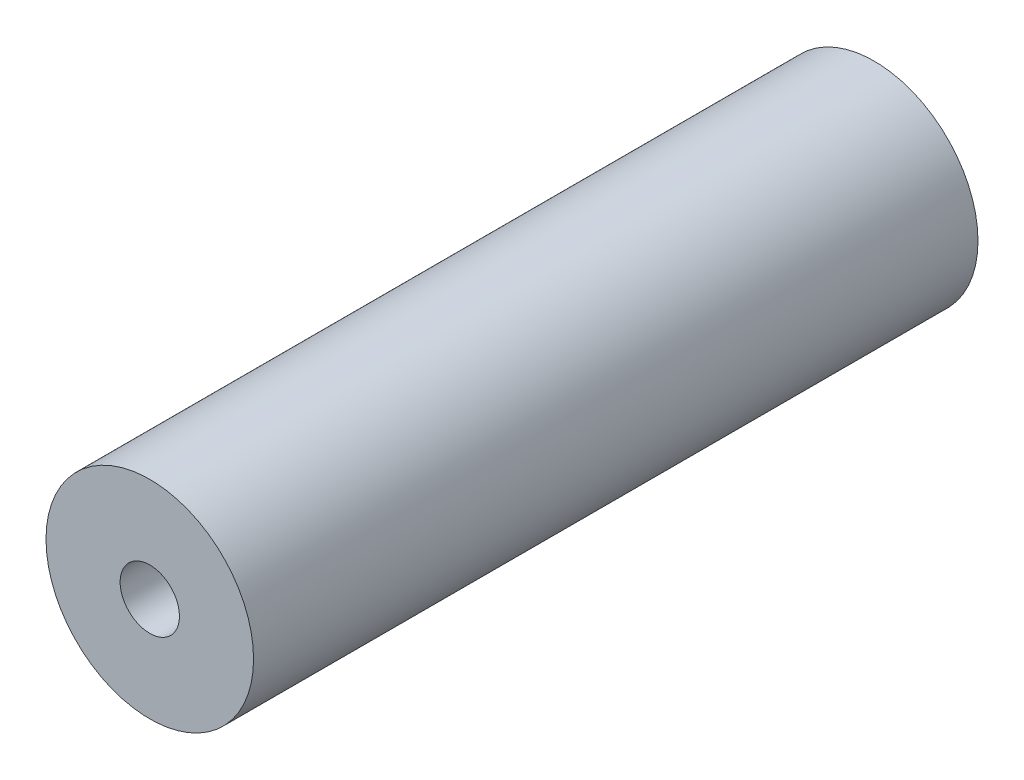
from build123d import *

# Parameters (mm, degrees)
SKETCH1_R           = 11.1125
SKETCH1_R_2         = 3.175
BOSS_EXTRUDE1_DEPTH = 77.5716


with BuildPart() as part:
    # Sketch1 → Boss-Extrude1 (new body)
    with BuildSketch(Plane.XY):
        Circle(SKETCH1_R)
        Circle(SKETCH1_R_2, mode=Mode.SUBTRACT)
    extrude(amount=BOSS_EXTRUDE1_DEPTH)


solid = part.part
